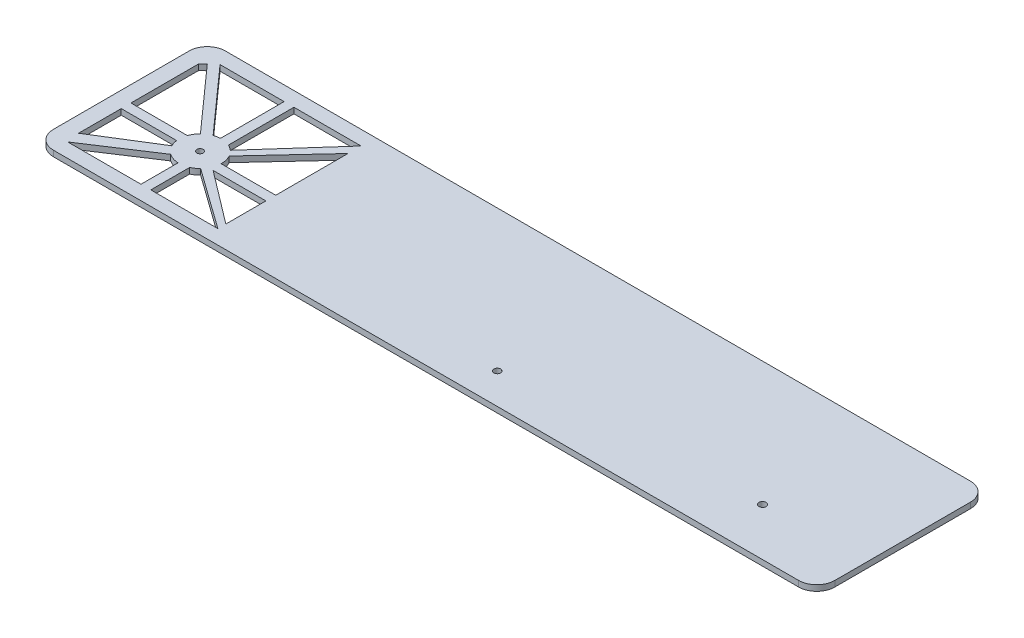
from build123d import *

# Parameters (mm, degrees)
SKETCH1_W           = 431.8
SKETCH1_H           = 95
SKETCH1_R           = 1.770184209
SKETCH1_R_2         = 1.902933344
SKETCH1_R_3         = 2
BOSS_EXTRUDE1_DEPTH = 3.175
FILLET1_R           = 10
SKETCH10_R          = 9.179936936
BOSS_EXTRUDE3_DEPTH = 3.175
SKETCH11_R          = 1.770587682
CUT_EXTRUDE5_DEPTH  = 3.175
CUT_EXTRUDE6_DEPTH  = 3.175
SKETCH13_R          = 11.741940518
BOSS_EXTRUDE4_DEPTH = 3.175
SKETCH14_R          = 1.762256498
CUT_EXTRUDE8_DEPTH  = 3.175


with BuildPart() as part:
    # Sketch1 → Boss-Extrude1 (new body)
    with BuildSketch(Plane(origin=(0, 0, 0), x_dir=(1, 0, 0), z_dir=(0, 1, 0))):
        with Locations((213.767466267, 47.5)):
            Rectangle(SKETCH1_W, SKETCH1_H)
        with Locations(Location((48.867466267, 40.050297191, 0), (0, 0, 270))):
            Circle(SKETCH1_R, mode=Mode.SUBTRACT)
        with Locations(Location((236.169368623, 16.995054431, 0), (0, 0, 270))):
            Circle(SKETCH1_R_2, mode=Mode.SUBTRACT)
        with Locations(Location((373.343160921, 26.368316597, 0), (0, 0, 270))):
            Circle(SKETCH1_R_3, mode=Mode.SUBTRACT)
    extrude(amount=BOSS_EXTRUDE1_DEPTH)

    # Fillet1
    fillet1_edges = [part.edges().sort_by_distance(p)[0] for p in [
        (-2.132533733, 1.5875, -95),
        (429.667466267, 1.5875, -95),
        (429.667466267, 1.5875, 0),
        (-2.132533733, 1.5875, 0),
    ]]
    fillet(fillet1_edges, radius=FILLET1_R)

    # Sketch10 → Boss-Extrude3 (add)
    with BuildSketch(Plane.XZ):
        with Locations((48.867466267, -40.050297191)):
            Circle(SKETCH10_R)
    extrude(amount=-BOSS_EXTRUDE3_DEPTH)

    # Sketch11 → Cut-Extrude5 (cut)
    with BuildSketch(Plane(origin=(0, 3.175, 0), x_dir=(1, 0, 0), z_dir=(0, 1, 0))):
        with Locations(Location((48.939345921, 40.088578466, 0), (0, 0, 270))):
            Circle(SKETCH11_R)
    extrude(amount=-CUT_EXTRUDE5_DEPTH, mode=Mode.SUBTRACT)

    # Sketch12 → Cut-Extrude6 (cut)
    with BuildSketch(Plane(origin=(0, 3.175, 0), x_dir=(1, 0, 0), z_dir=(0, 1, 0))):
        Polygon((48.341279917, 47.334727349), (48.341279917, 86.998039631), (12.939315235, 86.998039631), align=None)
        Polygon((44.60489186, 43.999769414), (9.202927178, 83.663081696), (6.684860974, 81.41555153), (6.684860974, 43.999769414), align=None)
        Polygon((44.60489186, 38.648134163), (6.684860974, 38.648134163), (6.684860974, 15.046824375), align=None)
        Polygon((7.853230038, 7.893935302), (48.341279917, 34.438493177), (48.341279917, 7.893935302), (44.60489186, 7.893935302), align=None)
        Polygon((55.459972177, 47.334727349), (90.838679195, 86.998039631), (55.459972177, 86.998039631), (53.759123425, 86.998039631), (53.759123425, 45.871199809), align=None)
        Polygon((90.838679195, 39.858977136), (90.838679195, 79.830290994), (55.833686687, 42.095331309), (55.833686687, 39.858977136), align=None)
        Polygon((53.759123425, 34.438493177), (53.759123425, 7.893935302), (90.838679195, 7.893935302), align=None)
        Polygon((61.64788979, 34.438493177), (90.838679195, 12.290395062), (90.838679195, 34.438493177), align=None)
    extrude(amount=-CUT_EXTRUDE6_DEPTH, mode=Mode.SUBTRACT)

    # Sketch13 → Boss-Extrude4 (add)
    with BuildSketch(Plane(origin=(0, 3.175, 0), x_dir=(1, 0, 0), z_dir=(0, 1, 0))):
        with Locations((48.939345921, 40.088578466)):
            Circle(SKETCH13_R)
    extrude(amount=-BOSS_EXTRUDE4_DEPTH)

    # Sketch14 → Cut-Extrude8 (cut)
    with BuildSketch(Plane(origin=(0, 3.175, 0), x_dir=(1, 0, 0), z_dir=(0, 1, 0))):
        with Locations(Location((48.870433526, 40.018247237, 0), (0, 0, 270))):
            Circle(SKETCH14_R)
    extrude(amount=-CUT_EXTRUDE8_DEPTH, mode=Mode.SUBTRACT)


solid = part.part
